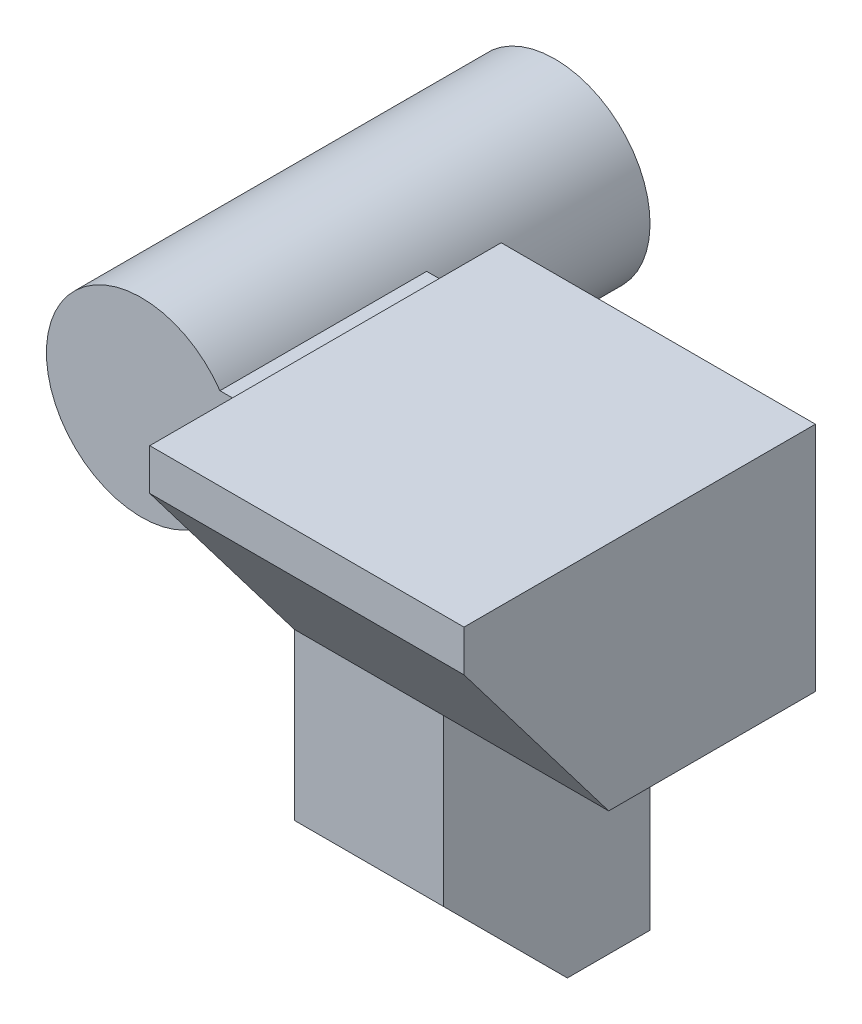
from build123d import *

# Parameters (mm, degrees)
SZKIC1_W                    = 7.6
SZKIC1_H                    = 5.6
DODANIE_WYCI_GNI_CIE1_DEPTH = 5
DODANIE_WYCI_GNI_CIE2_DEPTH = 5
SZKIC3_W                    = 3.6
SZKIC3_H                    = 7
DODANIE_WYCI_GNI_CIE3_DEPTH = 5
SZKIC4_R                    = 2.3
DODANIE_WYCI_GNI_CIE4_DEPTH = 5
SFAZOWANIE1_SIZE            = 3
DODANIE_WYCI_GNI_CIE5_DEPTH = 7.6


with BuildPart() as part:
    # Szkic1 → Dodanie-wyciągnięcie1 (new body)
    with BuildSketch(Plane.XY):
        Rectangle(SZKIC1_W, SZKIC1_H)
    extrude(amount=DODANIE_WYCI_GNI_CIE1_DEPTH)

    # Szkic2 → Dodanie-wyciągnięcie2 (add)
    with BuildSketch(Plane.XY.offset(5)):
        with BuildLine():
            Line((-6.955089184, -1.3), (-6.955089184, 1.3))
            Line((-6.955089184, 1.3), (-5.602633404, 1.3))
            ThreePointArc((-5.602633404, 1.3), (-9.8, 0), (-5.602633404, -1.3))
            Line((-5.602633404, -1.3), (-6.955089184, -1.3))
        make_face()
        with BuildLine():
            Line((-5.602633404, 1.3), (-6.955089184, 1.3))
            Line((-6.955089184, 1.3), (-6.955089184, -1.3))
            Line((-6.955089184, -1.3), (-5.602633404, -1.3))
            ThreePointArc((-5.602633404, -1.3), (-5.302962999, -0.680461913), (-5.2, 0))
            ThreePointArc((-5.2, 0), (-5.302962999, 0.680461913), (-5.602633404, 1.3))
        make_face()
        with BuildLine():
            Line((-3.8, 1.3), (-5.602633404, 1.3))
            ThreePointArc((-5.602633404, 1.3), (-5.302962999, 0.680461913), (-5.2, 0))
            ThreePointArc((-5.2, 0), (-5.302962999, -0.680461913), (-5.602633404, -1.3))
            Line((-5.602633404, -1.3), (-3.8, -1.3))
            Line((-3.8, -1.3), (-3.8, 1.3))
        make_face()
    extrude(amount=-DODANIE_WYCI_GNI_CIE2_DEPTH)

    # Szkic3 → Dodanie-wyciągnięcie3 (add)
    with BuildSketch(Plane.XY.offset(5)):
        with Locations((-2, -6.3)):
            Rectangle(SZKIC3_W, SZKIC3_H)
    extrude(amount=-DODANIE_WYCI_GNI_CIE3_DEPTH)

    # Szkic4 → Dodanie-wyciągnięcie4 (add)
    with BuildSketch(Plane(origin=(0, 0, 0), x_dir=(-1, 0, 0), z_dir=(0, 0, -1))):
        with Locations(Location((7.5, 0, 0), (0, 0, 145.58261129))):
            Circle(SZKIC4_R)
    extrude(amount=DODANIE_WYCI_GNI_CIE4_DEPTH)

    # Sfazowanie1
    sfazowanie1_edges = [part.edges().sort_by_distance(p)[0] for p in [
        (-2, -9.8, 5),
    ]]
    chamfer(sfazowanie1_edges, length=SFAZOWANIE1_SIZE)

    # Szkic5 → Dodanie-wyciągnięcie5 (add)
    with BuildSketch(Plane(origin=(3.8, 0, 0), x_dir=(0, 0, -1), z_dir=(1, 0, 0))):
        Polygon((-5, 2.8), (-8.5, 2.8), (-8.5, 1.8), (-5, -2.8), align=None)
    extrude(amount=-DODANIE_WYCI_GNI_CIE5_DEPTH)


solid = part.part
